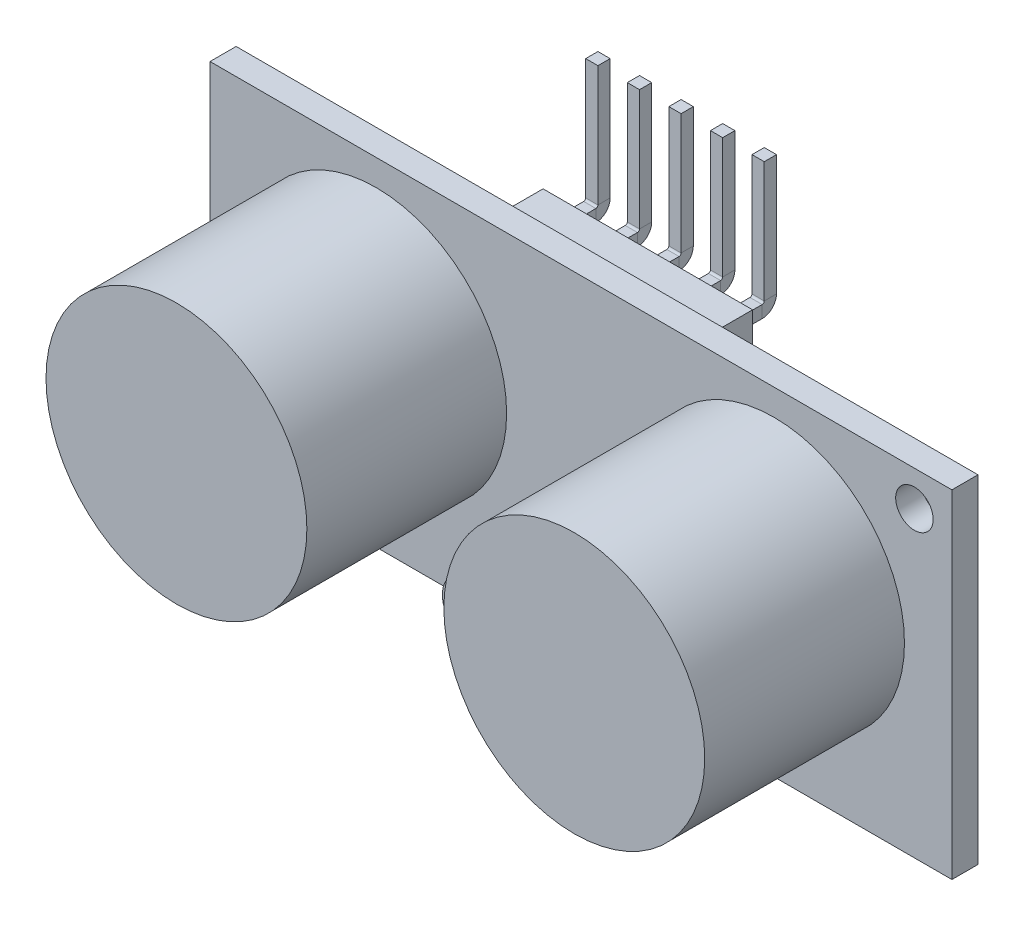
from build123d import *

# Parameters (mm, degrees)
SKETCH1_W           = 45.5
SKETCH1_H           = 20.7
BOSS_EXTRUDE1_DEPTH = 1.6
SKETCH2_R           = 8
BOSS_EXTRUDE2_DEPTH = 12.25
BOSS_EXTRUDE3_DEPTH = 3.5
SKETCH4_R           = 1.15
CUT_EXTRUDE1_DEPTH  = 3.5
SKETCH5_W           = 12.85
SKETCH5_H           = 2.6
BOSS_EXTRUDE4_DEPTH = 2.5
SKETCH6_W           = 0.75
SKETCH6_H           = 0.75
LPATTERN1_COUNT     = 5
LPATTERN1_PITCH     = 2.55


with BuildPart() as part:
    # Sketch1 → Boss-Extrude1 (new body)
    with BuildSketch(Plane.XY):
        Rectangle(SKETCH1_W, SKETCH1_H)
    extrude(amount=BOSS_EXTRUDE1_DEPTH)

    # Sketch2 → Boss-Extrude2 (add)
    with BuildSketch(Plane.XY.offset(1.6)):
        with Locations(Location((-12.56, 0.75, 0), (0, 0, 180))):
            Circle(SKETCH2_R)
        with Locations(Location((11.84, 0.75, 0), (0, 0, 180))):
            Circle(SKETCH2_R)
    extrude(amount=BOSS_EXTRUDE2_DEPTH)

    # Sketch3 → Boss-Extrude3 (add)
    with BuildSketch(Plane.XY.offset(1.6)):
        with BuildLine():
            Line((-3.2, -5.55), (3.2, -5.55))
            ThreePointArc((3.2, -5.55), (5, -7.35), (3.2, -9.15))
            Line((3.2, -9.15), (-3.2, -9.15))
            ThreePointArc((-3.2, -9.15), (-5, -7.35), (-3.2, -5.55))
        make_face()
    extrude(amount=BOSS_EXTRUDE3_DEPTH)

    # Sketch4 → Cut-Extrude1 (cut)
    with BuildSketch(Plane(origin=(0, 0, 0), x_dir=(-1, 0, 0), z_dir=(0, 0, -1))):
        with Locations((-20.45, 8.2)):
            Circle(SKETCH4_R)
        with Locations((20.6, -8.1)):
            Circle(SKETCH4_R)
    extrude(amount=-CUT_EXTRUDE1_DEPTH, mode=Mode.SUBTRACT)

    # Sketch5 → Boss-Extrude4 (add)
    with BuildSketch(Plane(origin=(0, 0, 0), x_dir=(-1, 0, 0), z_dir=(0, 0, -1))):
        with Locations((0, 8.4)):
            Rectangle(SKETCH5_W, SKETCH5_H)
    extrude(amount=BOSS_EXTRUDE4_DEPTH)

    # Sweep17: sweep along a path in Sketch7
    with BuildLine(Plane(origin=(5.14, 0, 0), x_dir=(0, -1, 0), z_dir=(1, 0, 0))) as sweep17_path:
        Line((-8.4, 2.5), (-8.4, 4))
        ThreePointArc((-8.4, 4), (-8.546446609, 4.353553391), (-8.9, 4.5))
        Line((-8.9, 4.5), (-16.3, 4.5))
    # Sketch6 → Sweep17 (sweep)
    with BuildSketch(Plane(origin=(0, 0, -2.5), x_dir=(-1, 0, 0), z_dir=(0, 0, -1))):
        with Locations((-5.14, 8.4)):
            Rectangle(SKETCH6_W, SKETCH6_H)
    sweep17 = sweep(path=sweep17_path.line)

    # LPattern1: Sweep17 ×5
    with Locations(*[(-i * LPATTERN1_PITCH, 0, 0) for i in range(1, LPATTERN1_COUNT)]):
        add(sweep17)


solid = part.part
